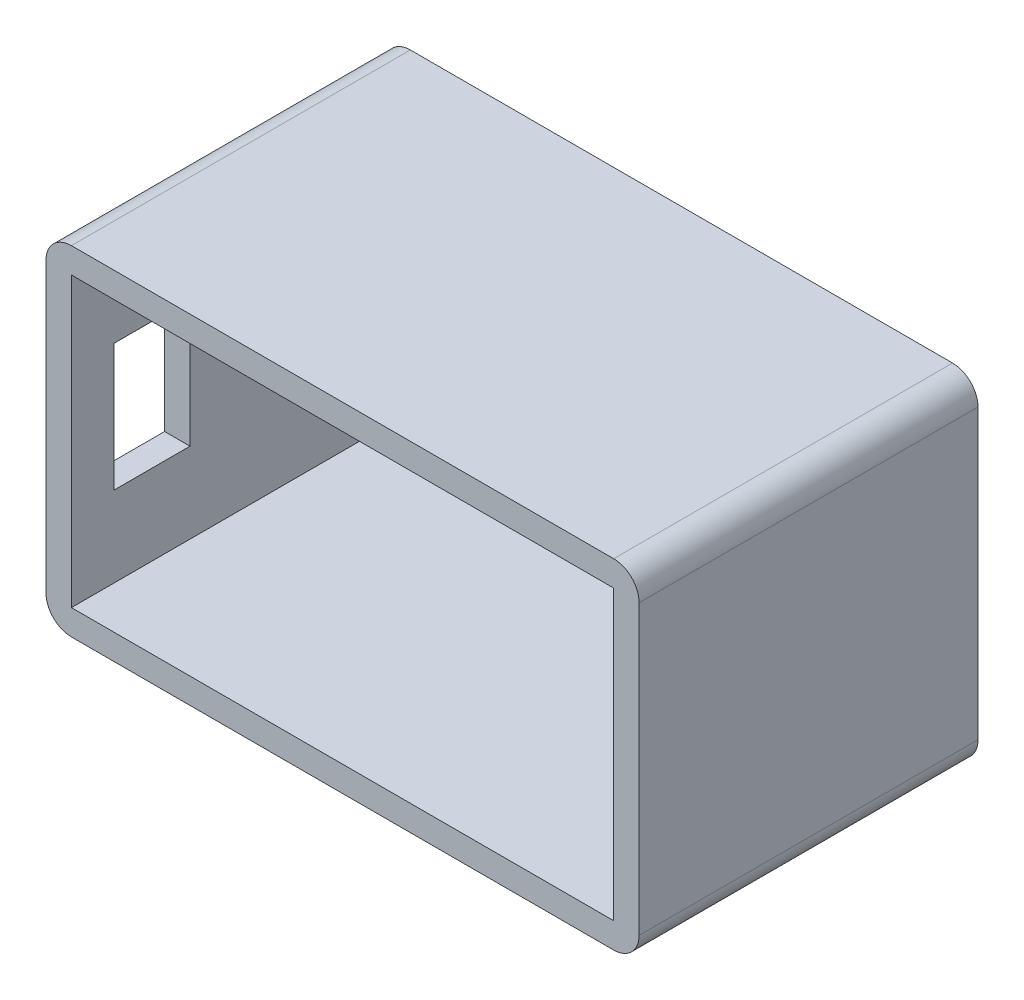
from build123d import *

# Parameters (mm, degrees)
SKETCH1_W           = 70
SKETCH1_H           = 40
BOSS_EXTRUDE2_DEPTH = 40
SHELL2_T            = -3
SKETCH2_R           = 3.5
CUT_EXTRUDE1_DEPTH  = 40
SKETCH5_W           = 9
SKETCH5_H           = 15
CUT_EXTRUDE2_DEPTH  = 40
FILLET1_R           = 3


with BuildPart() as part:
    # Sketch1 → Boss-Extrude2 (new body)
    with BuildSketch(Plane.XY):
        Rectangle(SKETCH1_W, SKETCH1_H)
    extrude(amount=BOSS_EXTRUDE2_DEPTH)

    # Shell2
    shell2_openings = [part.faces().sort_by_distance(p)[0] for p in [
        (0, 0, 40),
    ]]
    offset(amount=SHELL2_T, openings=shell2_openings, kind=Kind.INTERSECTION)

    # Sketch2 → Cut-Extrude1 (cut)
    with BuildSketch(Plane(origin=(0, 0, 0), x_dir=(-1, 0, 0), z_dir=(0, 0, -1))):
        Circle(SKETCH2_R)
    extrude(amount=-CUT_EXTRUDE1_DEPTH, mode=Mode.SUBTRACT)

    # Sketch5 → Cut-Extrude2 (cut)
    with BuildSketch(Plane.ZY.offset(35)):
        with Locations((30.5, 0)):
            Rectangle(SKETCH5_W, SKETCH5_H)
    extrude(amount=-CUT_EXTRUDE2_DEPTH, mode=Mode.SUBTRACT)

    # Fillet1
    fillet1_edges = [part.edges().sort_by_distance(p)[0] for p in [
        (35, -20, 20),
        (-35, -20, 20),
        (-35, 20, 20),
        (35, 20, 20),
    ]]
    fillet(fillet1_edges, radius=FILLET1_R)


solid = part.part
